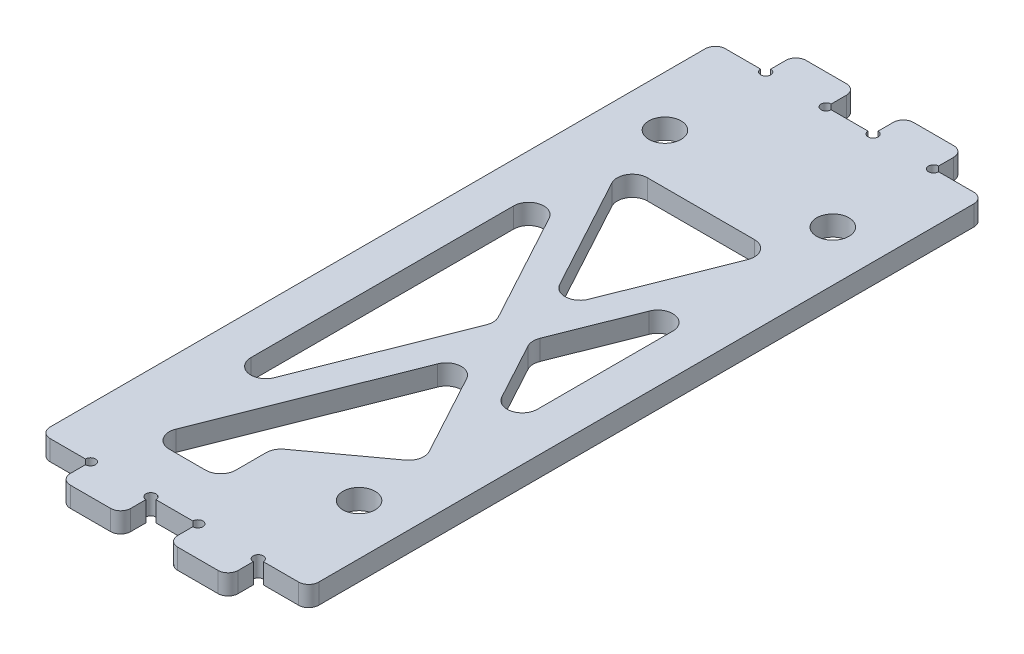
from build123d import *

# Parameters (mm, degrees)
SKETCH1_R           = 1.6
SKETCH1_W           = 6
SKETCH1_H           = 3
BOSS_EXTRUDE1_DEPTH = 2
FILLET1_R           = 1
SKETCH3_R           = 0.5
CUT_EXTRUDE1_DEPTH  = 2
SKETCH4_W           = 8.927318102
SKETCH4_H           = 47.063450143
SKETCH4_W_2         = 9.73496377
SKETCH4_H_2         = 34.688645835
CUT_EXTRUDE2_DEPTH  = 2
EXTRUDE_THIN1_DEPTH = 2
FILLET2_R           = 1.5


with BuildPart() as part:
    # Sketch1 → Boss-Extrude1 (new body)
    # profile 1 of 5: a face of its own
    with BuildSketch(Plane(origin=(0, 0, 0), x_dir=(1, 0, 0), z_dir=(0, 1, 0))):
        Polygon((6, 10), (0, 10), (-5, 10), (-5, -57.026436391), (0, -57.026436391), (6, -57.026436391), (10.662281872, -57.026436391), (16.662281872, -57.026436391), (21.662281872, -57.026436391), (21.662281872, 10), (16.662281872, 10), (10.662281872, 10), align=None)
        with Locations(Location((16.662281872, -47.026436391, 0), (0, 0, 270))):
            Circle(SKETCH1_R, mode=Mode.SUBTRACT)
        with Locations(Location((0, 0, 0), (0, 0, 270))):
            Circle(SKETCH1_R, mode=Mode.SUBTRACT)
        with Locations(Location((16.662281872, 0, 0), (0, 0, 270))):
            Circle(SKETCH1_R, mode=Mode.SUBTRACT)
    # profile 2 of 5: a face of its own
    with BuildSketch(Plane(origin=(0, 0, 0), x_dir=(1, 0, 0), z_dir=(0, 1, 0))):
        with Locations((13.662281872, 11.5)):
            Rectangle(SKETCH1_W, SKETCH1_H)
    # profile 3 of 5: a face of its own
    with BuildSketch(Plane(origin=(0, 0, 0), x_dir=(1, 0, 0), z_dir=(0, 1, 0))):
        with Locations((3, 11.5)):
            Rectangle(SKETCH1_W, SKETCH1_H)
    # profile 4 of 5: a face of its own
    with BuildSketch(Plane(origin=(0, 0, 0), x_dir=(1, 0, 0), z_dir=(0, 1, 0))):
        with Locations((3, -58.526436391)):
            Rectangle(SKETCH1_W, SKETCH1_H)
    # profile 5 of 5: a face of its own
    with BuildSketch(Plane(origin=(0, 0, 0), x_dir=(1, 0, 0), z_dir=(0, 1, 0))):
        with Locations((13.662281872, -58.526436391)):
            Rectangle(SKETCH1_W, SKETCH1_H)
    extrude(amount=BOSS_EXTRUDE1_DEPTH)

    # Fillet1
    fillet1_edges = [part.edges().sort_by_distance(p)[0] for p in [
        (21.662281872, 1, 57.026436391),
        (16.662281872, 1, 60.026436391),
        (10.662281872, 1, 60.026436391),
        (6, 1, 60.026436391),
        (0, 1, 60.026436391),
        (-5, 1, 57.026436391),
        (-5, 1, -10),
        (0, 1, -13),
        (6, 1, -13),
        (10.662281872, 1, -13),
        (16.662281872, 1, -13),
        (21.662281872, 1, -10),
    ]]
    fillet(fillet1_edges, radius=FILLET1_R)

    # Sketch3 → Cut-Extrude1 (cut)
    with BuildSketch(Plane.XZ):
        with Locations((0, 57.026436391)):
            Circle(SKETCH3_R)
        with Locations((6, 57.026436391)):
            Circle(SKETCH3_R)
        with Locations((10.662281872, 57.026436391)):
            Circle(SKETCH3_R)
        with Locations((16.662281872, 57.026436391)):
            Circle(SKETCH3_R)
        with Locations((0, -10)):
            Circle(SKETCH3_R)
        with Locations((6, -10)):
            Circle(SKETCH3_R)
        with Locations((10.662281872, -10)):
            Circle(SKETCH3_R)
        with Locations((16.662281872, -10)):
            Circle(SKETCH3_R)
    extrude(amount=-CUT_EXTRUDE1_DEPTH, mode=Mode.SUBTRACT)

    # Sketch4 → Cut-Extrude2 (cut)
    with BuildSketch(Plane(origin=(0, 2, 0), x_dir=(1, 0, 0), z_dir=(0, 1, 0))):
        with Locations((3.463659051, -28.49471132)):
            Rectangle(SKETCH4_W, SKETCH4_H)
        with Locations((12.794799987, -22.307309166)):
            Rectangle(SKETCH4_W_2, SKETCH4_H_2)
        Polygon((7.927318102, -39.651632083), (7.927318102, -46.759423391), (17.662281872, -39.651632083), align=None)
    extrude(amount=-CUT_EXTRUDE2_DEPTH, mode=Mode.SUBTRACT)

    # Sketch6 → Extrude-Thin1 (add)
    with BuildSketch(Plane(origin=(0, 2, 0), x_dir=(1, 0, 0), z_dir=(0, 1, 0))):
        Polygon((-2.318677564, -5.677891475), (17.181124518, -41.646227603), (19.818479645, -40.216417149), (0.318677564, -4.248081021), align=None)
        Polygon((16.267906789, -4.410068416), (-2.394375083, -51.473518559), (0.394375083, -52.579354223), (19.056656955, -5.51590408), align=None)
    extrude(amount=-EXTRUDE_THIN1_DEPTH)

    # Fillet2
    fillet2_edges = [part.edges().sort_by_distance(p)[0] for p in [
        (7.927318102, 1, 46.759423391),
        (7.927318102, 1, 52.026436391),
        (17.662281872, 1, 9.032306985),
        (17.662281872, 1, 36.239205179),
        (16.048655791, 1, 4.962986248),
        (0.706254859, 1, 4.962986248),
        (-1, 1, 47.957115655),
        (-1, 1, 8.110256565),
        (0.613626081, 1, 52.026436391),
        (16.542874861, 1, 40.468944978),
        (9.989723555, 1, 28.381337735),
        (9.567384345, 1, 21.307771825),
        (11.431310298, 1, 24.745874168),
        (8.125797601, 1, 24.943235392),
    ]]
    fillet(fillet2_edges, radius=FILLET2_R)


solid = part.part
